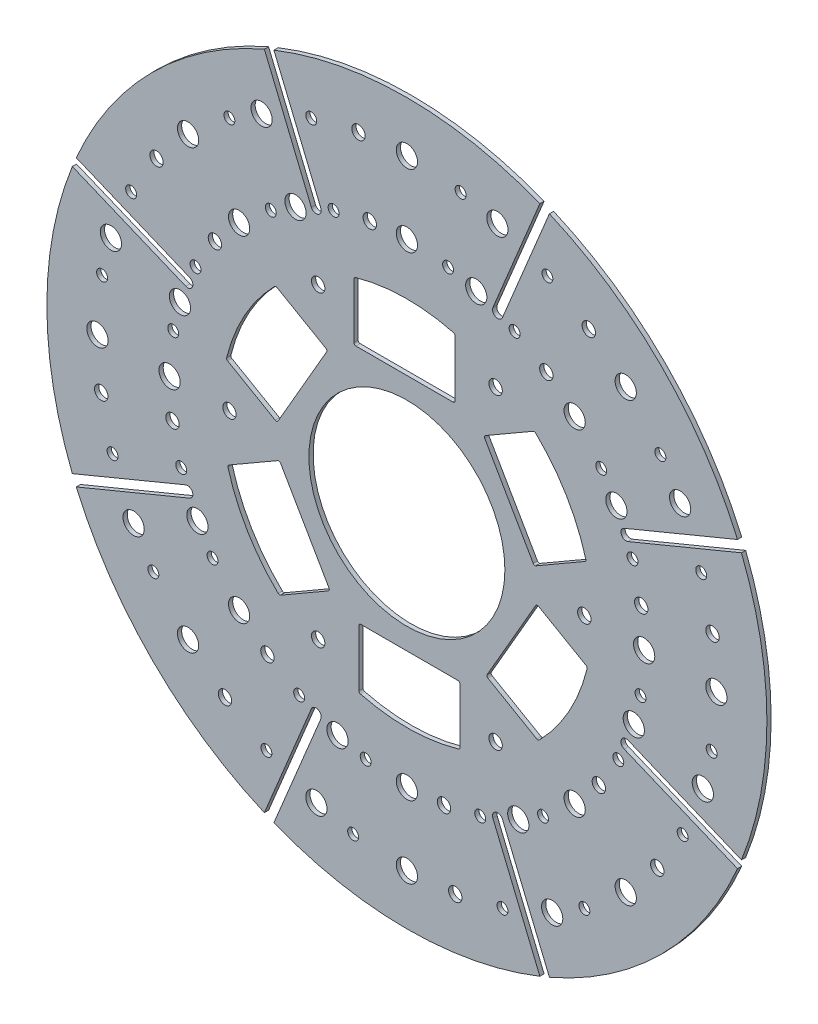
from build123d import *

# Parameters (mm, degrees)
ESBO_O1_R                = 174.5
ESBO_O1_R_2              = 47.5
RESSALTO_EXTRUS_O1_DEPTH = 2.05
CORTE_EXTRUS_O2_DEPTH    = 2.05
ESBO_O5_R                = 2.65
ESBO_O5_R_2              = 3.25
ESBO_O5_R_3              = 5.15
CORTE_EXTRUS_O3_DEPTH    = 2.05
CORTE_EXTRUS_O5_DEPTH    = 2.05
ESBO_O8_R                = 3.25
CORTE_EXTRUS_O6_DEPTH    = 2.05
FILETE1_R                = 1


with BuildPart() as part:
    # Esboço1 → Ressalto-extrusão1 (new body)
    with BuildSketch(Plane.XY):
        Circle(ESBO_O1_R)
        Circle(ESBO_O1_R_2, mode=Mode.SUBTRACT)
    extrude(amount=RESSALTO_EXTRUS_O1_DEPTH)

    # Esboço4 → Corte-extrusão2 (cut)
    with BuildSketch(Plane.XY.offset(2.05)):
        with BuildLine():
            Line((41.698895891, 107.20285482), (65.681843595, 165.102812432))
            Line((65.681843595, 165.102812432), (70.301241257, 163.18939527))
            Line((70.301241257, 163.18939527), (46.318293553, 105.289437658))
            ThreePointArc((46.318293553, 105.289437658), (43.051886141, 103.936447408), (41.698895891, 107.20285482))
        make_face()
        with BuildLine():
            Line((105.289437658, 46.318293553), (163.18939527, 70.301241257))
            Line((163.18939527, 70.301241257), (165.102812432, 65.681843595))
            Line((165.102812432, 65.681843595), (107.20285482, 41.698895891))
            ThreePointArc((107.20285482, 41.698895891), (103.936447408, 43.051886141), (105.289437658, 46.318293553))
        make_face()
        with BuildLine():
            Line((107.20285482, -41.698895891), (165.102812432, -65.681843595))
            Line((165.102812432, -65.681843595), (163.18939527, -70.301241257))
            Line((163.18939527, -70.301241257), (105.289437658, -46.318293553))
            ThreePointArc((105.289437658, -46.318293553), (103.936447408, -43.051886141), (107.20285482, -41.698895891))
        make_face()
        with BuildLine():
            Line((46.318293553, -105.289437658), (70.301241257, -163.18939527))
            Line((70.301241257, -163.18939527), (65.681843595, -165.102812432))
            Line((65.681843595, -165.102812432), (41.698895891, -107.20285482))
            ThreePointArc((41.698895891, -107.20285482), (43.051886141, -103.936447408), (46.318293553, -105.289437658))
        make_face()
        with BuildLine():
            Line((-41.698895891, -107.20285482), (-65.681843595, -165.102812432))
            Line((-65.681843595, -165.102812432), (-70.301241257, -163.18939527))
            Line((-70.301241257, -163.18939527), (-46.318293553, -105.289437658))
            ThreePointArc((-46.318293553, -105.289437658), (-43.051886141, -103.936447408), (-41.698895891, -107.20285482))
        make_face()
        with BuildLine():
            Line((-105.289437658, -46.318293553), (-163.18939527, -70.301241257))
            Line((-163.18939527, -70.301241257), (-165.102812432, -65.681843595))
            Line((-165.102812432, -65.681843595), (-107.20285482, -41.698895891))
            ThreePointArc((-107.20285482, -41.698895891), (-103.936447408, -43.051886141), (-105.289437658, -46.318293553))
        make_face()
        with BuildLine():
            Line((-107.20285482, 41.698895891), (-165.102812432, 65.681843595))
            Line((-165.102812432, 65.681843595), (-163.18939527, 70.301241257))
            Line((-163.18939527, 70.301241257), (-105.289437658, 46.318293553))
            ThreePointArc((-105.289437658, 46.318293553), (-103.936447408, 43.051886141), (-107.20285482, 41.698895891))
        make_face()
        with BuildLine():
            Line((-46.318293553, 105.289437658), (-70.301241257, 163.18939527))
            Line((-70.301241257, 163.18939527), (-65.681843595, 165.102812432))
            Line((-65.681843595, 165.102812432), (-41.698895891, 107.20285482))
            ThreePointArc((-41.698895891, 107.20285482), (-43.051886141, 103.936447408), (-46.318293553, 105.289437658))
        make_face()
    extrude(amount=-CORTE_EXTRUS_O2_DEPTH, mode=Mode.SUBTRACT)

    # Esboço5 → Corte-extrusão3 (cut)
    with BuildSketch(Plane.XY.offset(2.05)):
        with Locations((-46.352549156, 142.658477444)):
            Circle(ESBO_O5_R)
        with Locations((-23.465169756, 148.153251089)):
            Circle(ESBO_O5_R_2)
        with Locations((0, 150)):
            Circle(ESBO_O5_R_3)
        with Locations((26.04722665, 147.721162952)):
            Circle(ESBO_O5_R)
        with Locations((43.855755708, 143.445713394)):
            Circle(ESBO_O5_R_3)
        with Locations((-35.536954353, 109.371499374)):
            Circle(ESBO_O5_R)
        with Locations((-17.98996348, 113.584159168)):
            Circle(ESBO_O5_R_2)
        with Locations((0, 115)):
            Circle(ESBO_O5_R_3)
        with Locations((19.969540432, 113.252891596)):
            Circle(ESBO_O5_R)
        with Locations((33.622746043, 109.975046936)):
            Circle(ESBO_O5_R_3)
        with Locations((68.098574961, 133.650978628)):
            Circle(ESBO_O5_R)
        with Locations((88.167787844, 121.352549156)):
            Circle(ESBO_O5_R_2)
        with Locations((106.066017178, 106.066017178)):
            Circle(ESBO_O5_R_3)
        with Locations((122.872806643, 86.036465453)):
            Circle(ESBO_O5_R)
        with Locations((132.442138929, 70.420734418)):
            Circle(ESBO_O5_R_3)
        with Locations((52.20890747, 102.465750282)):
            Circle(ESBO_O5_R)
        with Locations((67.595304014, 93.036954353)):
            Circle(ESBO_O5_R_2)
        with Locations((81.317279836, 81.317279836)):
            Circle(ESBO_O5_R_3)
        with Locations((94.202485093, 65.96129018)):
            Circle(ESBO_O5_R)
        with Locations((101.538973179, 53.98922972)):
            Circle(ESBO_O5_R_3)
        with Locations((142.658477444, 46.352549156)):
            Circle(ESBO_O5_R)
        with Locations((148.153251089, 23.465169756)):
            Circle(ESBO_O5_R_2)
        with Locations((150, 0)):
            Circle(ESBO_O5_R_3)
        with Locations((147.721162952, -26.04722665)):
            Circle(ESBO_O5_R)
        with Locations((143.445713394, -43.855755708)):
            Circle(ESBO_O5_R_3)
        with Locations((109.371499374, 35.536954353)):
            Circle(ESBO_O5_R)
        with Locations((113.584159168, 17.98996348)):
            Circle(ESBO_O5_R_2)
        with Locations((115, 0)):
            Circle(ESBO_O5_R_3)
        with Locations((113.252891596, -19.969540432)):
            Circle(ESBO_O5_R)
        with Locations((109.975046936, -33.622746043)):
            Circle(ESBO_O5_R_3)
        with Locations((133.650978628, -68.098574961)):
            Circle(ESBO_O5_R)
        with Locations((121.352549156, -88.167787844)):
            Circle(ESBO_O5_R_2)
        with Locations((106.066017178, -106.066017178)):
            Circle(ESBO_O5_R_3)
        with Locations((86.036465453, -122.872806643)):
            Circle(ESBO_O5_R)
        with Locations((70.420734418, -132.442138929)):
            Circle(ESBO_O5_R_3)
        with Locations((102.465750282, -52.20890747)):
            Circle(ESBO_O5_R)
        with Locations((93.036954353, -67.595304014)):
            Circle(ESBO_O5_R_2)
        with Locations((81.317279836, -81.317279836)):
            Circle(ESBO_O5_R_3)
        with Locations((65.96129018, -94.202485093)):
            Circle(ESBO_O5_R)
        with Locations((53.98922972, -101.538973179)):
            Circle(ESBO_O5_R_3)
        with Locations((46.352549156, -142.658477444)):
            Circle(ESBO_O5_R)
        with Locations((23.465169756, -148.153251089)):
            Circle(ESBO_O5_R_2)
        with Locations((0, -150)):
            Circle(ESBO_O5_R_3)
        with Locations((-26.04722665, -147.721162952)):
            Circle(ESBO_O5_R)
        with Locations((-43.855755708, -143.445713394)):
            Circle(ESBO_O5_R_3)
        with Locations((35.536954353, -109.371499374)):
            Circle(ESBO_O5_R)
        with Locations((17.98996348, -113.584159168)):
            Circle(ESBO_O5_R_2)
        with Locations((0, -115)):
            Circle(ESBO_O5_R_3)
        with Locations((-19.969540432, -113.252891596)):
            Circle(ESBO_O5_R)
        with Locations((-33.622746043, -109.975046936)):
            Circle(ESBO_O5_R_3)
        with Locations((-68.098574961, -133.650978628)):
            Circle(ESBO_O5_R)
        with Locations((-88.167787844, -121.352549156)):
            Circle(ESBO_O5_R_2)
        with Locations((-106.066017178, -106.066017178)):
            Circle(ESBO_O5_R_3)
        with Locations((-122.872806643, -86.036465453)):
            Circle(ESBO_O5_R)
        with Locations((-132.442138929, -70.420734418)):
            Circle(ESBO_O5_R_3)
        with Locations((-52.20890747, -102.465750282)):
            Circle(ESBO_O5_R)
        with Locations((-67.595304014, -93.036954353)):
            Circle(ESBO_O5_R_2)
        with Locations((-81.317279836, -81.317279836)):
            Circle(ESBO_O5_R_3)
        with Locations((-94.202485093, -65.96129018)):
            Circle(ESBO_O5_R)
        with Locations((-101.538973179, -53.98922972)):
            Circle(ESBO_O5_R_3)
        with Locations((-142.658477444, -46.352549156)):
            Circle(ESBO_O5_R)
        with Locations((-148.153251089, -23.465169756)):
            Circle(ESBO_O5_R_2)
        with Locations((-150, 0)):
            Circle(ESBO_O5_R_3)
        with Locations((-147.721162952, 26.04722665)):
            Circle(ESBO_O5_R)
        with Locations((-143.445713394, 43.855755708)):
            Circle(ESBO_O5_R_3)
        with Locations((-109.371499374, -35.536954353)):
            Circle(ESBO_O5_R)
        with Locations((-113.584159168, -17.98996348)):
            Circle(ESBO_O5_R_2)
        with Locations((-115, 0)):
            Circle(ESBO_O5_R_3)
        with Locations((-113.252891596, 19.969540432)):
            Circle(ESBO_O5_R)
        with Locations((-109.975046936, 33.622746043)):
            Circle(ESBO_O5_R_3)
        with Locations((-133.650978628, 68.098574961)):
            Circle(ESBO_O5_R)
        with Locations((-121.352549156, 88.167787844)):
            Circle(ESBO_O5_R_2)
        with Locations((-106.066017178, 106.066017178)):
            Circle(ESBO_O5_R_3)
        with Locations((-86.036465453, 122.872806643)):
            Circle(ESBO_O5_R)
        with Locations((-70.420734418, 132.442138929)):
            Circle(ESBO_O5_R_3)
        with Locations((-102.465750282, 52.20890747)):
            Circle(ESBO_O5_R)
        with Locations((-93.036954353, 67.595304014)):
            Circle(ESBO_O5_R_2)
        with Locations((-81.317279836, 81.317279836)):
            Circle(ESBO_O5_R_3)
        with Locations((-65.96129018, 94.202485093)):
            Circle(ESBO_O5_R)
        with Locations((-53.98922972, 101.538973179)):
            Circle(ESBO_O5_R_3)
    extrude(amount=-CORTE_EXTRUS_O3_DEPTH, mode=Mode.SUBTRACT)

    # Esboço6 → Corte-extrusão5 (cut)
    with BuildSketch(Plane.XY.offset(2.05)):
        with BuildLine():
            Line((-25.688060376, 57.826848785), (23.311939624, 57.826848785))
            Line((23.311939624, 57.826848785), (23.311939624, 86.928438793))
            ThreePointArc((23.311939624, 86.928438793), (-1.23469844, 89.991530267), (-25.688060376, 86.256150819))
            Line((-25.688060376, 86.256150819), (-25.688060376, 57.826848785))
        make_face()
        with BuildLine():
            Line((37.235489881, 51.159937252), (61.735489881, 8.724692467))
            Line((61.735489881, 8.724692467), (86.938206118, 23.275487471))
            ThreePointArc((86.938206118, 23.275487471), (77.317602117, 46.065045348), (61.855987654, 65.374588269))
            Line((61.855987654, 65.374588269), (37.235489881, 51.159937252))
        make_face()
        with BuildLine():
            Line((62.923550257, -6.666911533), (38.423550257, -49.102156318))
            Line((38.423550257, -49.102156318), (63.626266494, -63.652951322))
            ThreePointArc((63.626266494, -63.652951322), (78.552300556, -43.926484919), (87.54404803, -20.88156255))
            Line((87.54404803, -20.88156255), (62.923550257, -6.666911533))
        make_face()
        with BuildLine():
            Line((25.688060376, -57.826848785), (-23.311939624, -57.826848785))
            Line((-23.311939624, -57.826848785), (-23.311939624, -86.928438793))
            ThreePointArc((-23.311939624, -86.928438793), (1.23469844, -89.991530267), (25.688060376, -86.256150819))
            Line((25.688060376, -86.256150819), (25.688060376, -57.826848785))
        make_face()
        with BuildLine():
            Line((-37.235489881, -51.159937252), (-61.735489881, -8.724692467))
            Line((-61.735489881, -8.724692467), (-86.938206118, -23.275487471))
            ThreePointArc((-86.938206118, -23.275487471), (-77.317602117, -46.065045348), (-61.855987654, -65.374588269))
            Line((-61.855987654, -65.374588269), (-37.235489881, -51.159937252))
        make_face()
        with BuildLine():
            Line((-62.923550257, 6.666911533), (-38.423550257, 49.102156318))
            Line((-38.423550257, 49.102156318), (-63.626266494, 63.652951322))
            ThreePointArc((-63.626266494, 63.652951322), (-78.552300556, 43.926484919), (-87.54404803, 20.88156255))
            Line((-87.54404803, 20.88156255), (-62.923550257, 6.666911533))
        make_face()
    extrude(amount=-CORTE_EXTRUS_O5_DEPTH, mode=Mode.SUBTRACT)

    # Esboço8 → Corte-extrusão6 (cut)
    with BuildSketch(Plane.XY.offset(2.05)):
        with Locations((43, 74.478184725)):
            Circle(ESBO_O8_R)
        with Locations((86, 0)):
            Circle(ESBO_O8_R)
        with Locations((43, -74.478184725)):
            Circle(ESBO_O8_R)
        with Locations((-43, -74.478184725)):
            Circle(ESBO_O8_R)
        with Locations((-86, 0)):
            Circle(ESBO_O8_R)
        with Locations((-43, 74.478184725)):
            Circle(ESBO_O8_R)
    extrude(amount=-CORTE_EXTRUS_O6_DEPTH, mode=Mode.SUBTRACT)

    # Filete1
    filete1_edges = [part.edges().sort_by_distance(p)[0] for p in [
        (-25.688060376, 57.826848785, 1.025),
        (-25.688060376, 86.256150819, 1.025),
        (23.311939624, 86.928438793, 1.025),
        (23.311939624, 57.826848785, 1.025),
        (37.235489881, 51.159937252, 1.025),
        (61.855987654, 65.374588269, 1.025),
        (86.938206118, 23.275487471, 1.025),
        (61.735489881, 8.724692467, 1.025),
        (62.923550257, -6.666911533, 1.025),
        (87.54404803, -20.88156255, 1.025),
        (63.626266494, -63.652951322, 1.025),
        (38.423550257, -49.102156318, 1.025),
        (25.688060376, -57.826848785, 1.025),
        (25.688060376, -86.256150819, 1.025),
        (-23.311939624, -86.928438793, 1.025),
        (-23.311939624, -57.826848785, 1.025),
        (-37.235489881, -51.159937252, 1.025),
        (-61.855987654, -65.374588269, 1.025),
        (-86.938206118, -23.275487471, 1.025),
        (-61.735489881, -8.724692467, 1.025),
        (-62.923550257, 6.666911533, 1.025),
        (-87.54404803, 20.88156255, 1.025),
        (-63.626266494, 63.652951322, 1.025),
        (-38.423550257, 49.102156318, 1.025),
    ]]
    fillet(filete1_edges, radius=FILETE1_R)


solid = part.part
